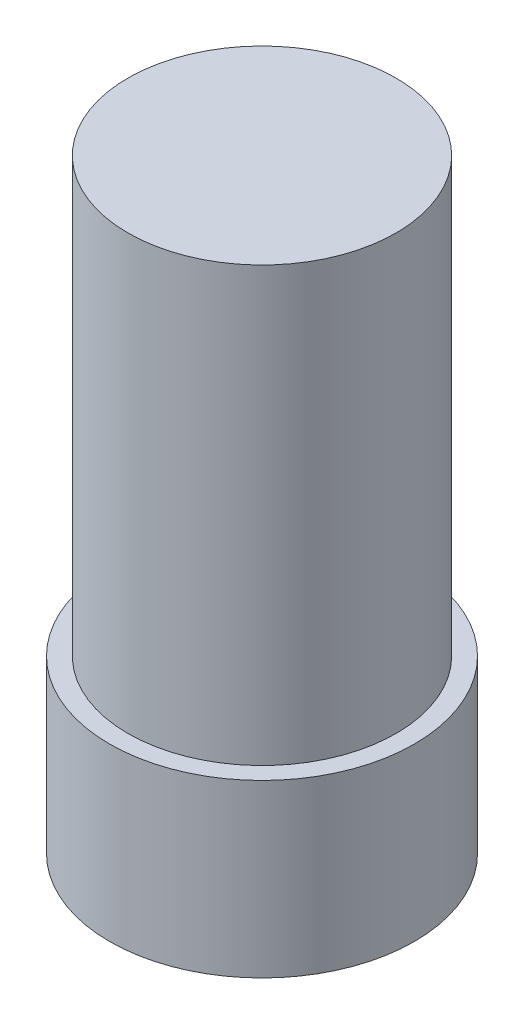
from build123d import *

# Parameters (mm, degrees)
SKETCH2_R                = 19.6
SKETCH2_R_2              = 12.25
BOSS_EXTRUDE1_DEPTH      = 22
BOSS_EXTRUDE2_DEPTH      = 55.75
BOSS_EXTRUDE2_DEPTH_BACK = 13
SKETCH3_R                = 17.25


with BuildPart() as part:
    # Sketch2 → Boss-Extrude1 (new body)
    with BuildSketch(Plane(origin=(0, 0, 0), x_dir=(1, 0, 0), z_dir=(0, 1, 0))):
        with Locations(Location((0, 0, 0), (0, 0, 270))):
            Circle(SKETCH2_R)
        with Locations(Location((0, 0, 0), (0, 0, 270))):
            Circle(SKETCH2_R_2, mode=Mode.SUBTRACT)
    extrude(amount=BOSS_EXTRUDE1_DEPTH)

    # Sketch3 → Boss-Extrude2 (add, two sides: drawn at the far end of the back side and taken through both)
    with BuildSketch(Plane(origin=(0, 22, 0), x_dir=(1, 0, 0), z_dir=(0, 1, 0)).offset(-BOSS_EXTRUDE2_DEPTH_BACK)):
        with Locations(Location((0, 0, 0), (0, 0, 270))):
            Circle(SKETCH3_R)
    extrude(amount=BOSS_EXTRUDE2_DEPTH + BOSS_EXTRUDE2_DEPTH_BACK)


solid = part.part
